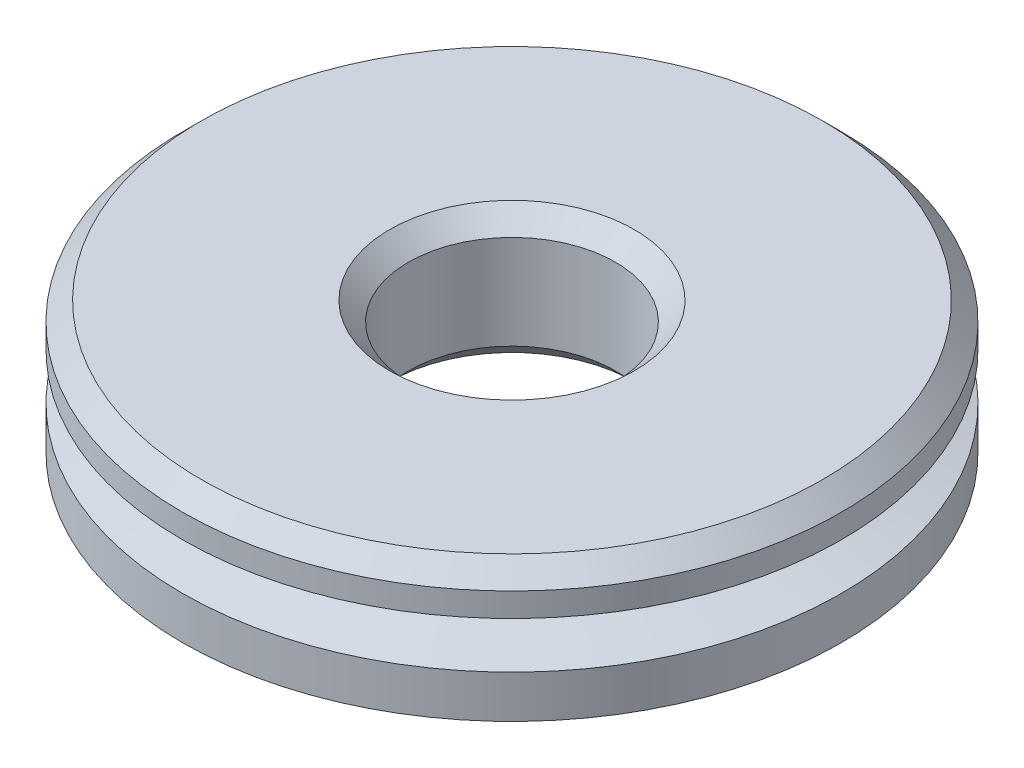
from build123d import *

# Parameters (mm, degrees)
CHAMFER2_SIZE = 2.54


with BuildPart() as part:
    # Sketch1 → Revolve-Thin2 (revolve)
    with BuildSketch(Plane.XY, mode=Mode.PRIVATE) as revolve_thin2_sk:
        Polygon((16.254988293, 6.35), (27.94, 9.480989451), (27.94, 15.24), (-2.54, 15.24), (-2.54, -2.54), (27.94, -2.54), (27.94, 3.219010549), align=None)
        with BuildLine():
            Line((15.597587918, 8.803451599), (25.4, 11.43))
            Line((25.4, 11.43), (25.4, 12.7))
            Line((25.4, 12.7), (0, 12.7))
            Line((0, 12.7), (0, 0))
            Line((0, 0), (25.4, 0))
            Line((25.4, 0), (25.4, 1.27))
            Line((25.4, 1.27), (15.597587918, 3.896548401))
            ThreePointArc((15.597587918, 3.896548401), (13.714988293, 6.35), (15.597587918, 8.803451599))
        make_face(mode=Mode.SUBTRACT)
    revolve(revolve_thin2_sk.sketch.rotate(Axis((-16.51, 12.7, 0), (0, -1, 0)), 90), axis=Axis((-16.51, 12.7, 0), (0, -1, 0)))

    # Chamfer2
    chamfer2_edges = [part.edges().sort_by_distance(p)[0] for p in [
        (-16.51, -2.54, -13.97),
        (-16.51, 15.24, -13.97),
        (-16.51, 15.24, -44.45),
    ]]
    chamfer(chamfer2_edges, length=CHAMFER2_SIZE)


solid = part.part
